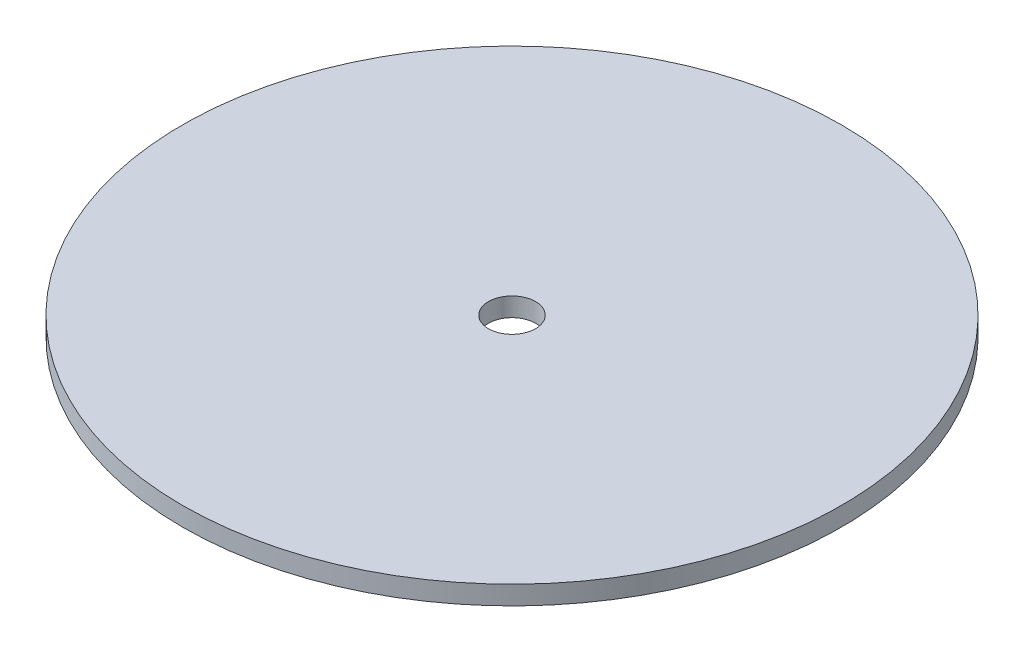
from build123d import *

# Parameters (mm, degrees)
SKETCH1_R           = 140
SKETCH1_R_2         = 10
BOSS_EXTRUDE1_DEPTH = 8


with BuildPart() as part:
    # Sketch1 → Boss-Extrude1 (new body)
    with BuildSketch(Plane(origin=(0, 0, 0), x_dir=(1, 0, 0), z_dir=(0, 1, 0))):
        with Locations(Location((0, 0, 0), (0, 0, 270))):
            Circle(SKETCH1_R)
        with Locations(Location((0, 0, 0), (0, 0, 270))):
            Circle(SKETCH1_R_2, mode=Mode.SUBTRACT)
    extrude(amount=BOSS_EXTRUDE1_DEPTH)


solid = part.part
